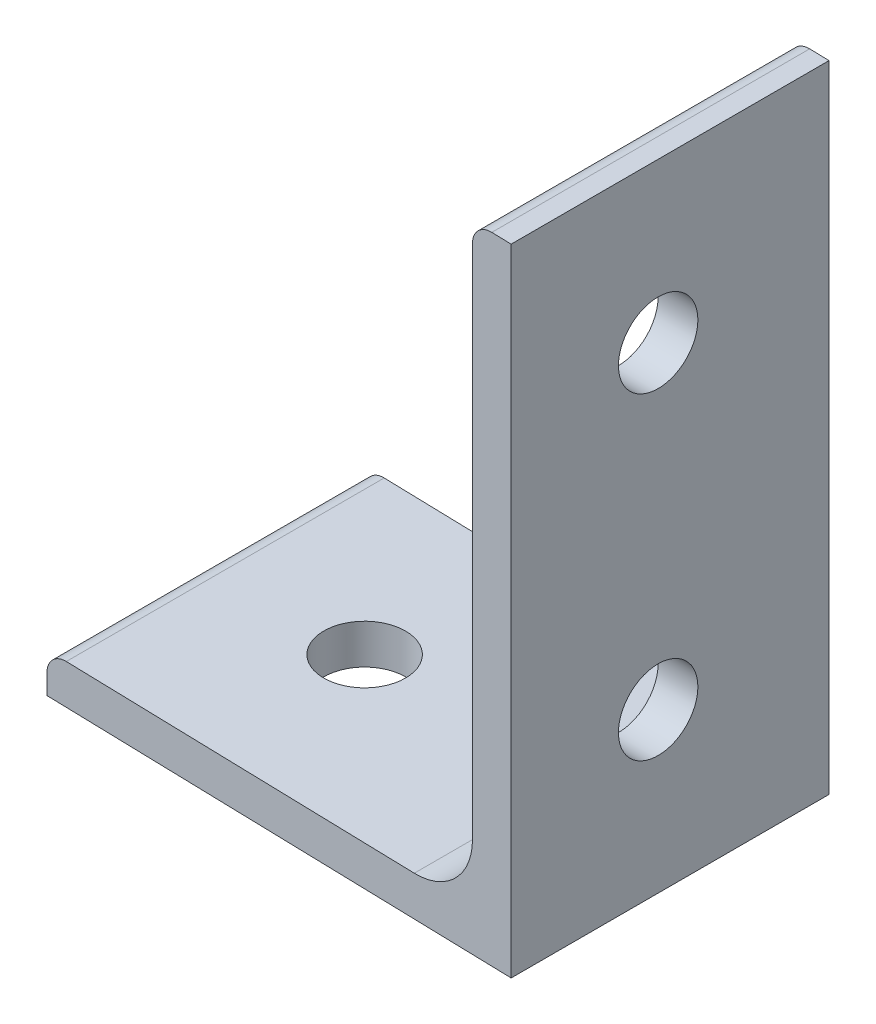
from build123d import *

# Parameters (mm, degrees)
BOSS_EXTRUDE1_DEPTH     = 15.875
SKETCH4_R               = 3.175
CUT_EXTRUDE1_DEPTH      = 49.464271634
SKETCH3_OUTSIDE_W       = 54.3
SKETCH3_OUTSIDE_H       = 47.95
CUT_EXTRUDE2_DEPTH      = 57.529267862
F_1_4_CLEARANCE_HOLE1_D = 6.5278
SKETCH9_R               = 6.35
CUT_EXTRUDE3_DEPTH      = 2.54


with BuildPart() as part:
    # Sketch2 → Boss-Extrude1 (new, symmetric)
    with BuildSketch(Plane.XY):
        with BuildLine():
            Line((-19.05, -25.4), (19.05, -25.4))
            Line((19.05, -25.4), (19.05, 25.4))
            Line((19.05, 25.4), (17.4625, 25.4))
            ThreePointArc((17.4625, 25.4), (16.339967985, 24.935032015), (15.875, 23.8125))
            Line((15.875, 23.8125), (15.875, -17.4498))
            ThreePointArc((15.875, -17.4498), (14.476376302, -20.826376302), (11.0998, -22.225))
            Line((11.0998, -22.225), (-17.4625, -22.225))
            ThreePointArc((-17.4625, -22.225), (-18.585032015, -22.689967985), (-19.05, -23.8125))
            Line((-19.05, -23.8125), (-19.05, -25.4))
        make_face()
    extrude(amount=BOSS_EXTRUDE1_DEPTH, both=True)

    # Sketch4 → Cut-Extrude1 (cut, through all)
    with BuildSketch(Plane(origin=(19.05, 0, 0), x_dir=(0, 0, -1), z_dir=(1, 0, 0))):
        with Locations(Location((-3.175, 12.7, 0), (0, 0, 90))):
            Circle(SKETCH4_R)
        with Locations(Location((-3.175, -12.7, 0), (0, 0, 90))):
            Circle(SKETCH4_R)
    extrude(amount=-CUT_EXTRUDE1_DEPTH, mode=Mode.SUBTRACT)

    # Sketch3 outside → Cut-Extrude2 (cut, through all)
    with BuildSketch(Plane.XZ.offset(25.4)):
        Rectangle(SKETCH3_OUTSIDE_W, SKETCH3_OUTSIDE_H)
        Polygon((-19.05, 13.926834826), (-19.05, -11.481872103), (19.05, -10.484188491), (19.05, 14.924518438), align=None, mode=Mode.SUBTRACT)
    extrude(amount=-CUT_EXTRUDE2_DEPTH, mode=Mode.SUBTRACT)

    # 1/4 Clearance Hole1 (through all)
    with Locations(Plane(origin=(0, -25.4, 0), x_dir=(-1, 0, 0), z_dir=(0, -1, 0))):
        with Locations((6.021904729, -1.56363455)):
            Hole(F_1_4_CLEARANCE_HOLE1_D / 2)

    # Sketch9 → Cut-Extrude3 (cut)
    with BuildSketch(Plane.ZY.offset(-15.875)):
        with Locations((3.175, -12.7)):
            Circle(SKETCH9_R)
    extrude(amount=CUT_EXTRUDE3_DEPTH, mode=Mode.SUBTRACT)


solid = part.part
